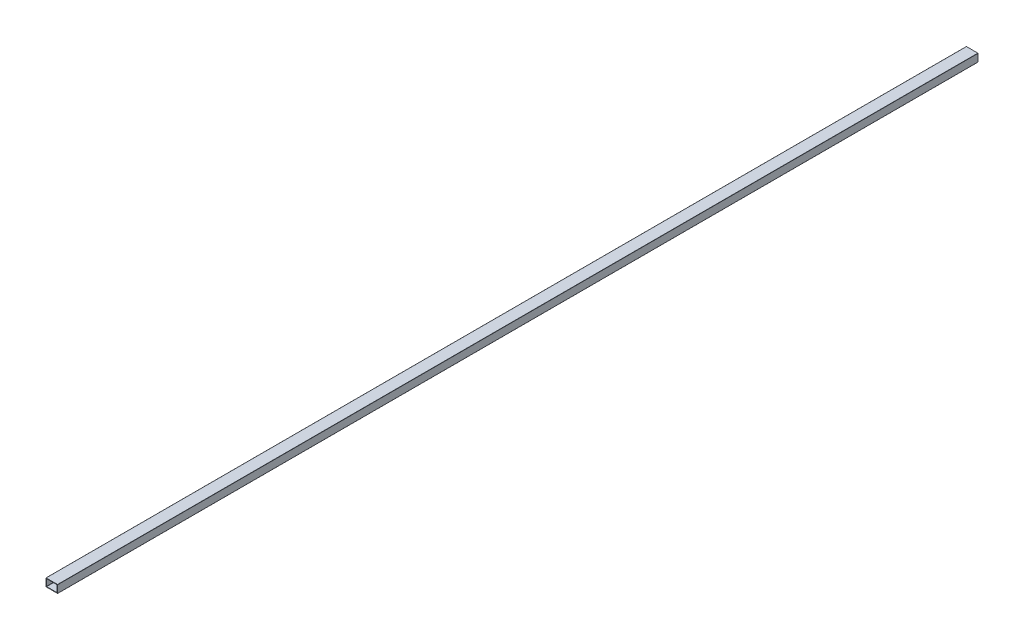
from build123d import *

# Parameters (mm, degrees)
CROQUIS1_W              = 76.2
CROQUIS1_H              = 50.8
CROQUIS1_W_2            = 70.12
CROQUIS1_H_2            = 44.72
SALIENTE_EXTRUIR1_DEPTH = 6000
REDONDEO1_R             = 1


with BuildPart() as part:
    # Croquis1 → Saliente-Extruir1 (new body)
    with BuildSketch(Plane.XY):
        Rectangle(CROQUIS1_W, CROQUIS1_H)
        Rectangle(CROQUIS1_W_2, CROQUIS1_H_2, mode=Mode.SUBTRACT)
    extrude(amount=-SALIENTE_EXTRUIR1_DEPTH)

    # Redondeo1
    redondeo1_edges = [part.edges().sort_by_distance(p)[0] for p in [
        (35.06, -22.36, -3000),
        (-35.06, -22.36, -3000),
        (-35.06, 22.36, -3000),
        (35.06, 22.36, -3000),
        (38.1, -25.4, -3000),
        (-38.1, -25.4, -3000),
        (-38.1, 25.4, -3000),
        (38.1, 25.4, -3000),
    ]]
    fillet(redondeo1_edges, radius=REDONDEO1_R)


solid = part.part
